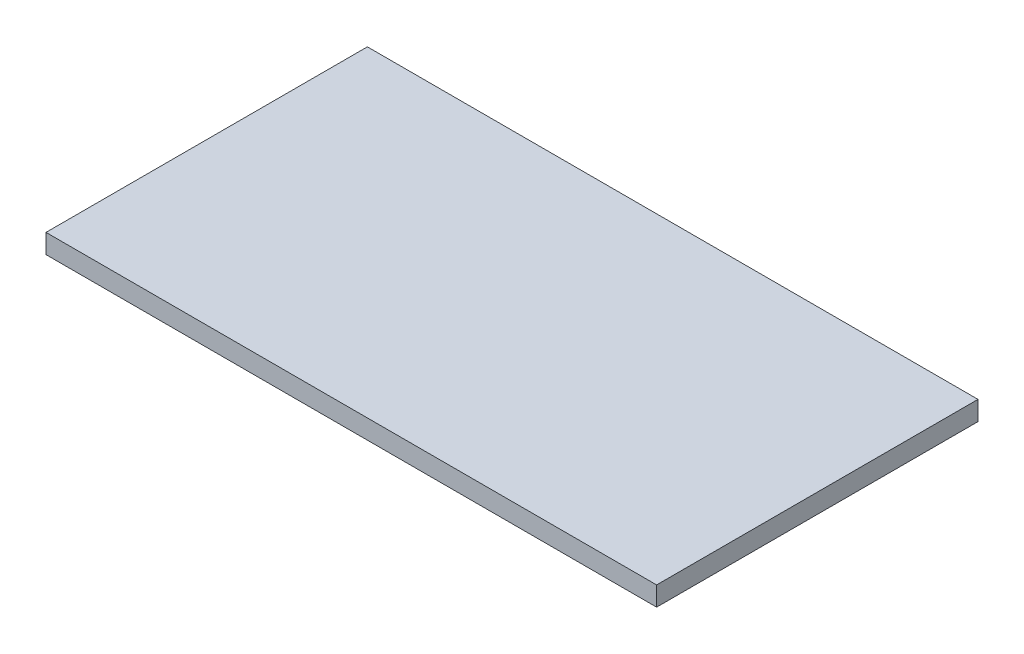
from build123d import *

# Parameters (mm, degrees)
ESBO_O2_W                = 120
ESBO_O2_H                = 100
RESSALTO_EXTRUS_O1_DEPTH = 6
ESBO_O3_W                = 100
ESBO_O3_H                = 6
RESSALTO_EXTRUS_O3_DEPTH = 70


with BuildPart() as part:
    # Esboço2 → Ressalto-extrusão1 (new body)
    with BuildSketch(Plane(origin=(0, 0, 0), x_dir=(1, 0, 0), z_dir=(0, 1, 0))):
        with Locations((60, 50)):
            Rectangle(ESBO_O2_W, ESBO_O2_H)
    extrude(amount=RESSALTO_EXTRUS_O1_DEPTH)

    # Esboço3 → Ressalto-extrusão3 (add)
    with BuildSketch(Plane.ZY):
        with Locations((-50, 3)):
            Rectangle(ESBO_O3_W, ESBO_O3_H)
    extrude(amount=RESSALTO_EXTRUS_O3_DEPTH)


solid = part.part
